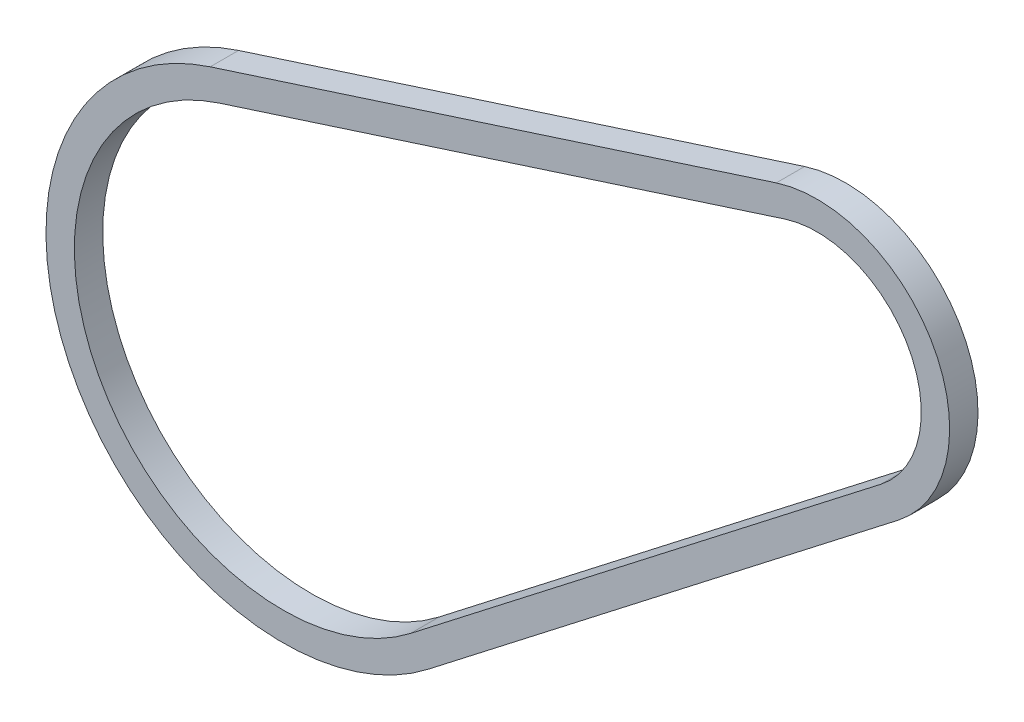
from build123d import *

# Parameters (mm, degrees)
EXTRUIR_L_MINA1_DEPTH = 5


with BuildPart() as part:
    # Croquis2 → Extruir-Lámina1 (new, symmetric)
    with BuildSketch(Plane.XY):
        with BuildLine():
            Line((216.809413948, 62.328412579), (51.135249039, -66.010880207))
            ThreePointArc((51.135249039, -66.010880207), (-73.851069865, -38.964977606), (-25.623428751, 79.471314945))
            Line((-25.623428751, 79.471314945), (173.833747041, 143.781018846))
            ThreePointArc((173.833747041, 143.781018846), (229.527553152, 121.102320995), (216.809413948, 62.328412579))
        make_face()
        with BuildLine():
            Line((210.685432027, 70.233907214), (45.011267118, -58.105385571))
            ThreePointArc((45.011267118, -58.105385571), (-65.00663036, -34.298513222), (-22.554754649, 69.953792197))
            Line((-22.554754649, 69.953792197), (176.902421143, 134.263496098))
            ThreePointArc((176.902421143, 134.263496098), (220.683113648, 116.435856611), (210.685432027, 70.233907214))
        make_face(mode=Mode.SUBTRACT)
    extrude(amount=EXTRUIR_L_MINA1_DEPTH, both=True)


solid = part.part
